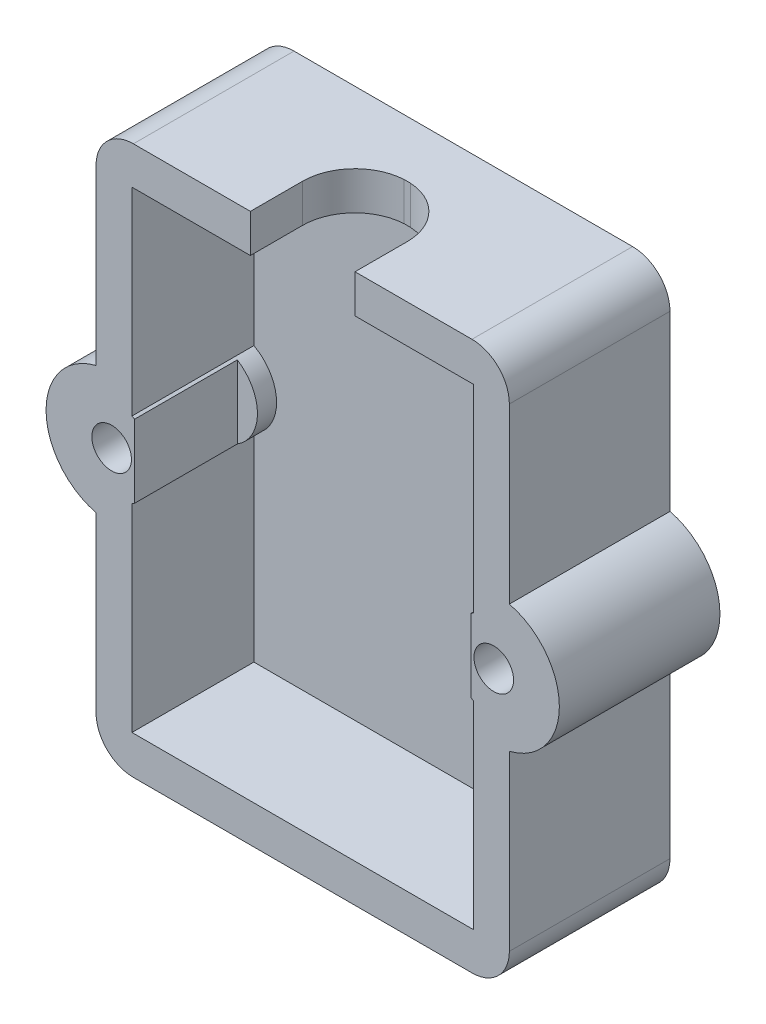
from build123d import *

# Parameters (mm, degrees)
BOSS_EXTRUDE2_DEPTH = 8.595
CUT_EXTRUDE3_REACH  = 34.509
SKETCH5_R           = 1.06
CUT_EXTRUDE4_DEPTH  = 6.525
CUT_EXTRUDE2_REACH  = 35.54
SKETCH7_W           = 18
SKETCH7_H           = 24.65
CUT_EXTRUDE6_DEPTH  = 5.5


with BuildPart() as part:
    # Sketch1 → Boss-Extrude2 (new body)
    with BuildSketch(Plane.XY):
        with BuildLine():
            Line((-11.06, 0.816412174), (-11.06, 10.090766215))
            ThreePointArc((-11.06, 10.090766215), (-13.735, 13.5), (-11.06, 16.909233785))
            Line((-11.06, 16.909233785), (-11.06, 26.183587826))
            ThreePointArc((-11.06, 26.183587826), (-10.474213562, 27.597801388), (-9.06, 28.183587826))
            Line((-9.06, 28.183587826), (9.06, 28.183587826))
            ThreePointArc((9.06, 28.183587826), (10.474213562, 27.597801388), (11.06, 26.183587826))
            Line((11.06, 26.183587826), (11.06, 16.909233785))
            ThreePointArc((11.06, 16.909233785), (13.735, 13.5), (11.06, 10.090766215))
            Line((11.06, 10.090766215), (11.06, 0.816412174))
            ThreePointArc((11.06, 0.816412174), (10.474213562, -0.597801388), (9.06, -1.183587826))
            Line((9.06, -1.183587826), (-9.06, -1.183587826))
            ThreePointArc((-9.06, -1.183587826), (-10.474213562, -0.597801388), (-11.06, 0.816412174))
        make_face()
    extrude(amount=BOSS_EXTRUDE2_DEPTH)

    # Sketch5 → Cut-Extrude3 (cut, up to next)
    with BuildSketch(Plane.XY.offset(8.595), mode=Mode.PRIVATE) as cut_extrude3_sk1:
        with Locations((-10.225, 13.5)):
            Circle(SKETCH5_R)
    cut_extrude3_tool1 = extrude(cut_extrude3_sk1.sketch, amount=-CUT_EXTRUDE3_REACH, mode=Mode.PRIVATE) & part.part
    # Sketch5 → Cut-Extrude3 (cut, up to next)
    with BuildSketch(Plane.XY.offset(8.595), mode=Mode.PRIVATE) as cut_extrude3_sk2:
        with Locations(Location((10.225, 13.5, 0), (0, 0, 180))):
            Circle(SKETCH5_R)
    cut_extrude3_tool2 = extrude(cut_extrude3_sk2.sketch, amount=-CUT_EXTRUDE3_REACH, mode=Mode.PRIVATE) & part.part
    add(cut_extrude3_tool1.solids().sort_by_distance((-10.225, 13.5, 8.595))[0], mode=Mode.SUBTRACT)
    add(cut_extrude3_tool2.solids().sort_by_distance((10.225, 13.5, 8.595))[0], mode=Mode.SUBTRACT)

    # Sketch2 → Cut-Extrude4 (cut)
    with BuildSketch(Plane.XY.offset(8.595)):
        with BuildLine():
            Line((-9.1375, 15.528570386), (-9.1375, 26.136412174))
            Line((-9.1375, 26.136412174), (9.1375, 26.136412174))
            Line((9.1375, 26.136412174), (9.1375, 15.528570386))
            ThreePointArc((9.1375, 15.528570386), (7.923314952, 13.5), (9.1375, 11.471429614))
            Line((9.1375, 11.471429614), (9.1375, 0.861412174))
            Line((9.1375, 0.861412174), (-9.1375, 0.861412174))
            Line((-9.1375, 0.861412174), (-9.1375, 11.471429614))
            ThreePointArc((-9.1375, 11.471429614), (-7.923314952, 13.5), (-9.1375, 15.528570386))
        make_face()
    extrude(amount=-CUT_EXTRUDE4_DEPTH, mode=Mode.SUBTRACT)

    # Sketch3 → Cut-Extrude2 (cut, up to next)
    with BuildSketch(Plane(origin=(0, 28.183587826, 0), x_dir=(1, 0, 0), z_dir=(0, 1, 0)), mode=Mode.PRIVATE) as cut_extrude2_sk1:
        with BuildLine():
            Line((0.167257287, -3.005), (-0.167257287, -3.005))
            ThreePointArc((-0.167257287, -3.005), (-2.038175704, -3.880145891), (-2.8, -5.8))
            Line((-2.8, -5.8), (-2.8, -8.595))
            Line((-2.8, -8.595), (-0.167257287, -8.595))
            Line((-0.167257287, -8.595), (0.167257287, -8.595))
            Line((0.167257287, -8.595), (2.8, -8.595))
            Line((2.8, -8.595), (2.8, -5.8))
            ThreePointArc((2.8, -5.8), (2.038175704, -3.880145891), (0.167257287, -3.005))
        make_face()
    cut_extrude2_tool1 = extrude(cut_extrude2_sk1.sketch, amount=-CUT_EXTRUDE2_REACH, mode=Mode.PRIVATE) & part.part
    add(cut_extrude2_tool1.solids().sort_by_distance((0, 28.183588, 6.058962))[0], mode=Mode.SUBTRACT)

    # Sketch7 → Cut-Extrude6 (cut)
    with BuildSketch(Plane.XY.offset(8.595)):
        with Locations((0, 13.548319596)):
            Rectangle(SKETCH7_W, SKETCH7_H)
    extrude(amount=-CUT_EXTRUDE6_DEPTH, mode=Mode.SUBTRACT)


solid = part.part
